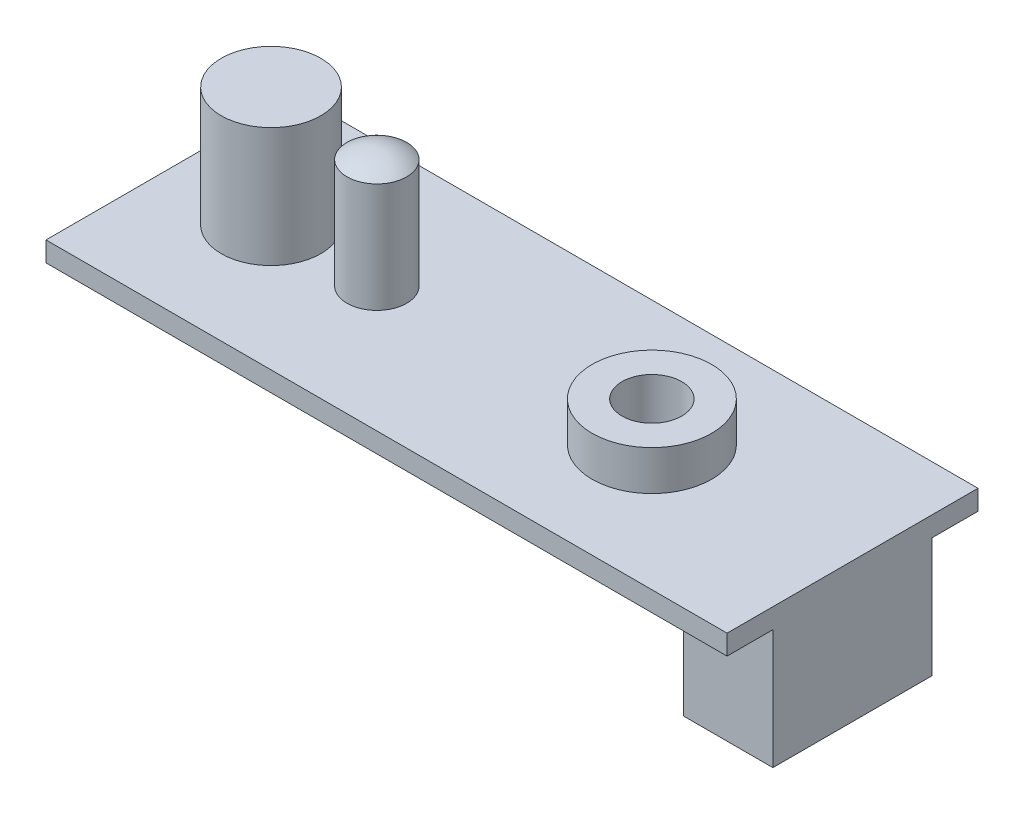
from build123d import *

# Parameters (mm, degrees)
SKETCH_1_W          = 34.2
SKETCH_1_H          = 12.6
EXTRUDE_1_DEPTH     = 1
SKETCH_2_R          = 2.5
EXTRUDE_2_DEPTH     = 6
SKETCH_3_R          = 1.5
EXTRUDE_3_DEPTH     = 5.5
DOME_3_FACE_RADIUS  = 1.5
DOME_3_HEIGHT       = 0.5
SKETCH_4_R          = 1.5
CUT_EXTRUDE_1_DEPTH = 20.185932346
EXTRUDE_START       = 2
SKETCH_5_R          = 3
SKETCH_5_R_2        = 1.5
EXTRUDE_4_DEPTH     = 2
SKETCH_6_W          = 4.5
SKETCH_6_H          = 8
EXTRUDE_6_DEPTH     = 6
SKETCH_7_W          = 3.38323666
SKETCH_7_H          = 6.498483094
CUT_EXTRUDE_2_DEPTH = 5


with BuildPart() as part:
    # 草图1 → 凸台-拉伸1 (new body)
    with BuildSketch(Plane(origin=(0, 0, 0), x_dir=(1, 0, 0), z_dir=(0, 1, 0))):
        Rectangle(SKETCH_1_W, SKETCH_1_H)
    extrude(amount=EXTRUDE_1_DEPTH)

    # 草图2 → 凸台-拉伸2 (add)
    with BuildSketch(Plane(origin=(0, 1, 0), x_dir=(1, 0, 0), z_dir=(0, 1, 0))):
        with Locations(Location((-12.1, 0, 0), (0, 0, 270))):
            Circle(SKETCH_2_R)
    extrude(amount=EXTRUDE_2_DEPTH)

    # 草图3 → 凸台-拉伸3 (add)
    with BuildSketch(Plane(origin=(0, 1, 0), x_dir=(1, 0, 0), z_dir=(0, 1, 0))):
        with Locations(Location((-6.786156124, 0, 0), (0, 0, 270))):
            Circle(SKETCH_3_R)
    extrude(amount=EXTRUDE_3_DEPTH)

    # 圆顶3: a dome of height H over a round flat face of radius A is a cap of a sphere of radius (A * A + H * H) / (2 * H)
    dome_3_r = (DOME_3_FACE_RADIUS * DOME_3_FACE_RADIUS + DOME_3_HEIGHT * DOME_3_HEIGHT) / (2 * DOME_3_HEIGHT)
    dome_3_base = Plane((-6.786156124, 6.5, 0), z_dir=(0, 1, 0))
    with Locations(dome_3_base.offset(DOME_3_HEIGHT - dome_3_r)):
        dome_3_ball = Sphere(dome_3_r, mode=Mode.PRIVATE)
    add(split(dome_3_ball, bisect_by=dome_3_base, keep=Keep.TOP, mode=Mode.PRIVATE))

    # 草图4 → 切除-拉伸1 (cut, through all)
    with BuildSketch(Plane(origin=(0, 1, 0), x_dir=(1, 0, 0), z_dir=(0, 1, 0))):
        with Locations(Location((7.02445794, 0, 0), (0, 0, 270))):
            Circle(SKETCH_4_R)
    extrude(amount=-CUT_EXTRUDE_1_DEPTH, mode=Mode.SUBTRACT)

    # 草图5 → 凸台-拉伸4 (add)
    with BuildSketch(Plane(origin=(0, 1, 0), x_dir=(1, 0, 0), z_dir=(0, 1, 0)).offset(EXTRUDE_START)):
        with Locations(Location((7.02445794, 0, 0), (0, 0, 270))):
            Circle(SKETCH_5_R)
        with Locations(Location((7.02445794, 0, 0), (0, 0, 270))):
            Circle(SKETCH_5_R_2, mode=Mode.SUBTRACT)
    extrude(amount=-EXTRUDE_4_DEPTH)

    # 草图6 → 凸台-拉伸6 (add)
    with BuildSketch(Plane(origin=(0, 0, 0), x_dir=(-1, 0, 0), z_dir=(0, -1, 0))):
        with Locations((-14.85, 0)):
            Rectangle(SKETCH_6_W, SKETCH_6_H)
    extrude(amount=EXTRUDE_6_DEPTH)

    # 草图7 → 切除-拉伸2 (cut)
    with BuildSketch(Plane.XZ.offset(6)):
        with Locations((14.85, 0)):
            Rectangle(SKETCH_7_W, SKETCH_7_H)
    extrude(amount=-CUT_EXTRUDE_2_DEPTH, mode=Mode.SUBTRACT)


solid = part.part
